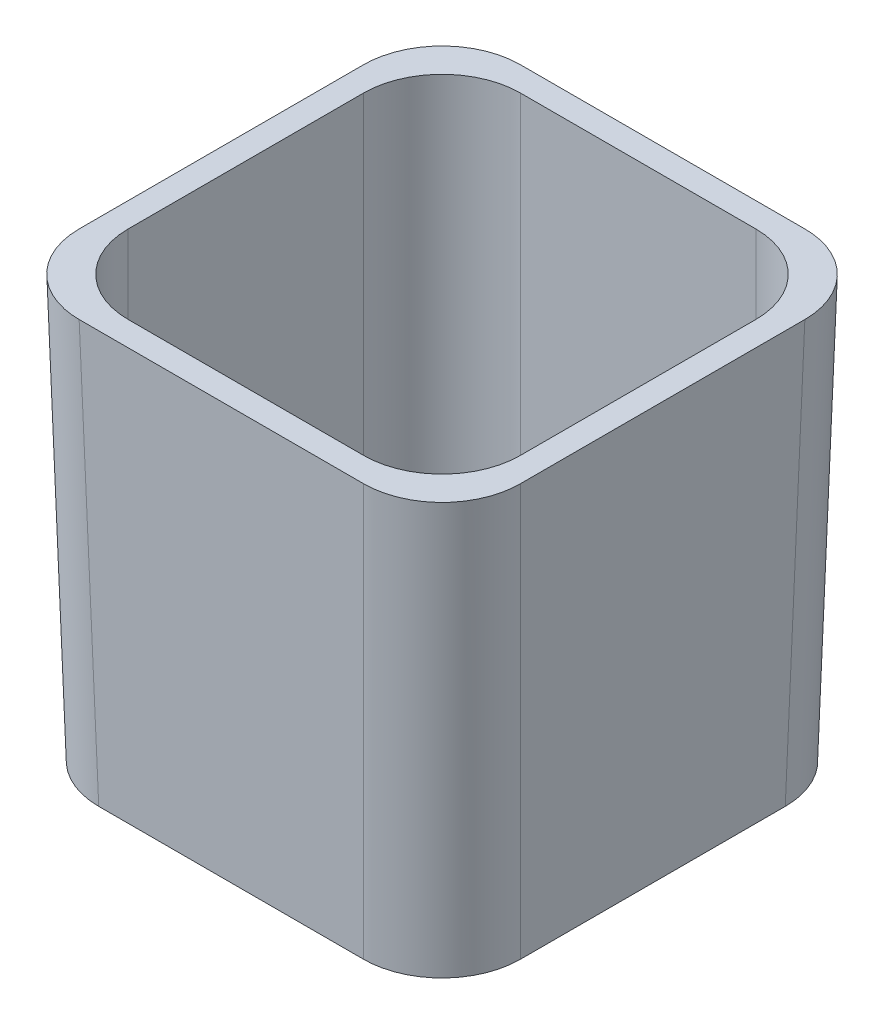
from build123d import *

# Parameters (mm, degrees)
SKETCH5_W          = 80
SKETCH5_H          = 80
CUT_EXTRUDE1_DEPTH = 81
FILLET1_R          = 16


with BuildPart() as part:
    # Sketch4 → Loft1 section 0
    with BuildSketch(Plane(origin=(0, 86, -86), x_dir=(1, 0, 0), z_dir=(0, 1, 0))):
        with BuildLine():
            Line((88, 2), (88, -88))
            Line((88, -88), (-2, -88))
            Line((-2, -88), (-2, 2))
            Line((-2, 2), (88, 2))
        make_face()
    # Sketch2 → Loft1 section 1
    with BuildSketch(Plane(origin=(0, 0, 0), x_dir=(1, 0, 0), z_dir=(0, 1, 0))):
        with BuildLine():
            Line((0, 0), (86, 0))
            Line((86, 0), (86, 86))
            Line((86, 86), (0, 86))
            Line((0, 86), (0, 0))
        make_face()
    loft()

    # Sketch5 → Cut-Extrude1 (cut)
    with BuildSketch(Plane(origin=(0, 86, 0), x_dir=(1, 0, 0), z_dir=(0, 1, 0))):
        with Locations((43, 43)):
            Rectangle(SKETCH5_W, SKETCH5_H)
    extrude(amount=-CUT_EXTRUDE1_DEPTH, mode=Mode.SUBTRACT)

    # Fillet1
    fillet1_edges = [part.edges().sort_by_distance(p)[0] for p in [
        (87, 43, -87),
        (83, 45.5, -83),
        (87, 43, 1),
        (83, 45.5, -3),
        (-1, 43, 1),
        (3, 45.5, -3),
        (-1, 43, -87),
        (3, 45.5, -83),
    ]]
    fillet(fillet1_edges, radius=FILLET1_R)


solid = part.part
